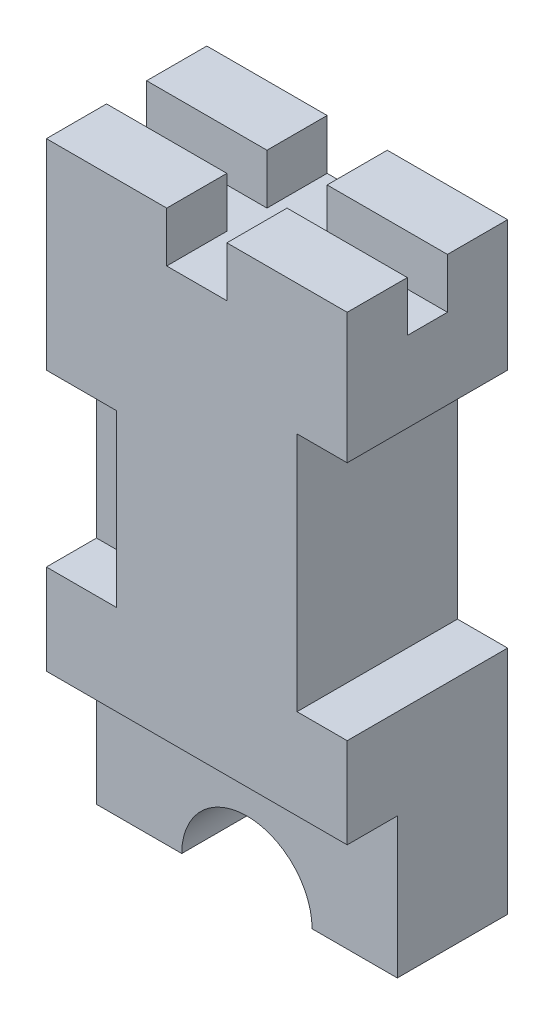
from build123d import *

# Parameters (mm, degrees)
SKETCH_1_W          = 30
SKETCH_1_H          = 60
EXTRUDE_1_DEPTH     = 16
SKETCH_2_W          = 4
SKETCH_2_H          = 5
SKETCH_2_W_2        = 5
SKETCH_2_H_2        = 14
CUT_EXTRUDE_1_DEPTH = 46.343136195
SKETCH_3_R          = 6.5
SKETCH_3_W          = 6
SKETCH_3_H          = 5
CUT_EXTRUDE_2_DEPTH = 38.161808352
SKETCH_4_W          = 5
SKETCH_4_H          = 17
CUT_EXTRUDE_3_DEPTH = 38.161808352
SKETCH_5_W          = 7
SKETCH_5_H          = 17
CUT_EXTRUDE_4_DEPTH = 5
SKETCH_6_W          = 5
SKETCH_6_H          = 16
CUT_EXTRUDE_5_DEPTH = 7


with BuildPart() as part:
    # Эскиз1 → Бобышка-Вытянуть1 (new body)
    with BuildSketch(Plane.XY):
        Rectangle(SKETCH_1_W, SKETCH_1_H)
    extrude(amount=EXTRUDE_1_DEPTH)

    # Эскиз2 → Вырез-Вытянуть1 (cut, through all)
    with BuildSketch(Plane.ZY.offset(15)):
        with Locations((8, 27.5)):
            Rectangle(SKETCH_2_W, SKETCH_2_H)
        with Locations((13.5, -23)):
            Rectangle(SKETCH_2_W_2, SKETCH_2_H_2)
    extrude(amount=-CUT_EXTRUDE_1_DEPTH, mode=Mode.SUBTRACT)

    # Эскиз3 → Вырез-Вытянуть2 (cut, through all)
    with BuildSketch(Plane.XY.offset(16)):
        with Locations((0, -30)):
            Circle(SKETCH_3_R)
        with Locations((0, 27.5)):
            Rectangle(SKETCH_3_W, SKETCH_3_H)
    extrude(amount=-CUT_EXTRUDE_2_DEPTH, mode=Mode.SUBTRACT)

    # Эскиз4 → Вырез-Вытянуть3 (cut, through all)
    with BuildSketch(Plane.XY.offset(16)):
        with Locations((12.5, 1.5)):
            Rectangle(SKETCH_4_W, SKETCH_4_H)
    extrude(amount=-CUT_EXTRUDE_3_DEPTH, mode=Mode.SUBTRACT)

    # Эскиз5 → Вырез-Вытянуть4 (cut)
    with BuildSketch(Plane.XY.offset(16)):
        with Locations((-11.5, 1.5)):
            Rectangle(SKETCH_5_W, SKETCH_5_H)
    extrude(amount=-CUT_EXTRUDE_4_DEPTH, mode=Mode.SUBTRACT)

    # Эскиз6 → Вырез-Вытянуть5 (cut)
    with BuildSketch(Plane.XZ.offset(-10)):
        with Locations((12.5, 8)):
            Rectangle(SKETCH_6_W, SKETCH_6_H)
    extrude(amount=-CUT_EXTRUDE_5_DEPTH, mode=Mode.SUBTRACT)


solid = part.part
